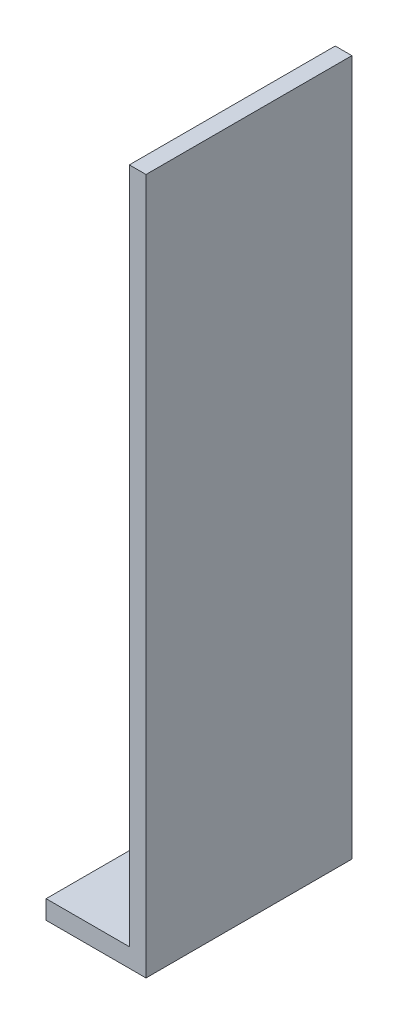
from build123d import *

# Parameters (mm, degrees)
BOSS_EXTRUDE1_DEPTH = 68
CUT_EXTRUDE1_START  = -18
CUT_EXTRUDE1_DEPTH  = 18


with BuildPart() as part:
    # Sketch1 → Boss-Extrude1 (new body)
    with BuildSketch(Plane.XY):
        Polygon((0, -65.175603221), (24.260410468, -65.175603221), (24.260410468, 103.824396779), (20.214170688, 103.824396779), (20.214170688, -60.620021665), (0, -60.620021665), align=None)
    extrude(amount=BOSS_EXTRUDE1_DEPTH)

    # Sketch2 → Cut-Extrude1 (cut)
    with BuildSketch(Plane(origin=(0, 0, 0), x_dir=(-1, 0, 0), z_dir=(0, 0, -1)).offset(CUT_EXTRUDE1_START)):
        Polygon((0, -65.175603221), (0, -60.620021665), (-20.214170688, -60.620021665), (-20.214170688, 103.824396779), (-24.260410468, 103.824396779), (-24.260410468, -65.175603221), align=None)
    extrude(amount=CUT_EXTRUDE1_DEPTH, mode=Mode.SUBTRACT)


solid = part.part
